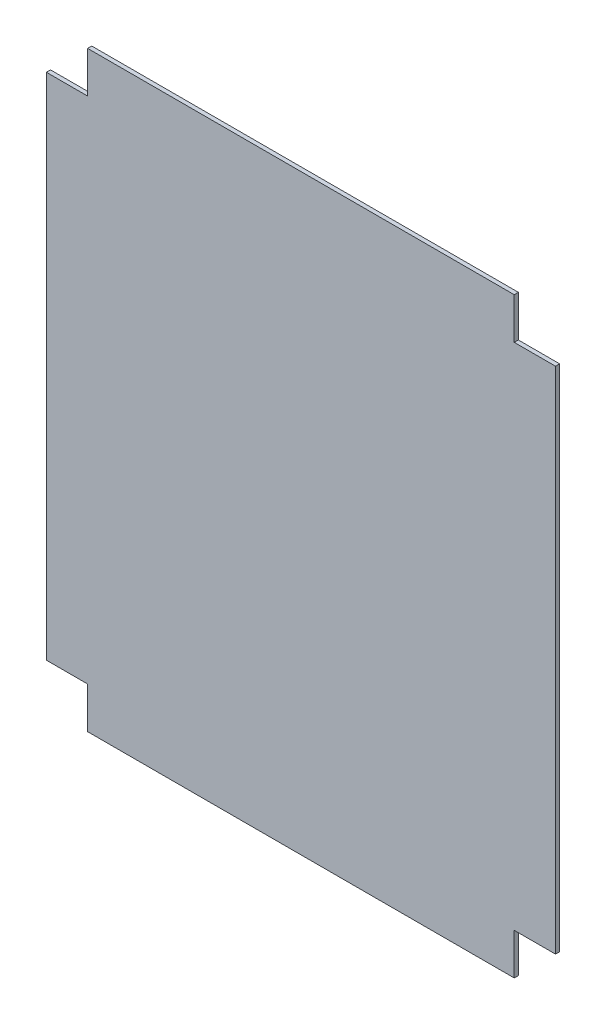
from build123d import *

# Parameters (mm, degrees)
EXTRUDE_1_DEPTH = 3


with BuildPart() as part:
    # 스케치1 → 보스-돌출1 (new body)
    with BuildSketch(Plane.XY):
        Polygon((-155, -185), (-155, -215), (155, -215), (155, -185), (185, -185), (185, 185), (155, 185), (155, 215), (-155, 215), (-155, 185), (-185, 185), (-185, -185), align=None)
    extrude(amount=EXTRUDE_1_DEPTH)


solid = part.part
